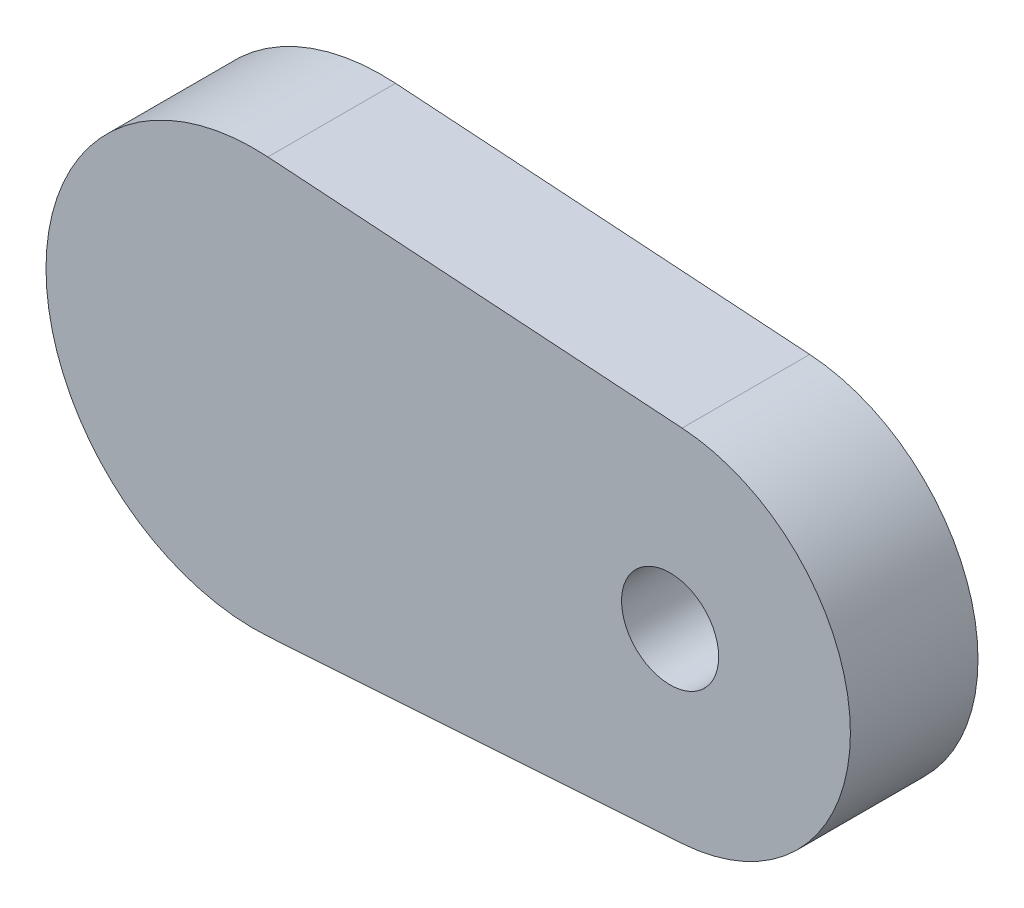
from build123d import *

# Parameters (mm, degrees)
SKETCH1_R      = 1.75
EXTRUDE1_DEPTH = 4.6


with BuildPart() as part:
    # Sketch1 → Extrude1 (new body)
    with BuildSketch(Plane.XY):
        with BuildLine():
            Line((18.056741052, 10.042362485), (32.990074385, 11.040137788))
            ThreePointArc((32.990074385, 11.040137788), (39.056741052, 17.525677258), (32.990074385, 24.011216728))
            Line((32.990074385, 24.011216728), (18.056741052, 25.008992032))
            ThreePointArc((18.056741052, 25.008992032), (10.056741052, 17.525677258), (18.056741052, 10.042362485))
        make_face()
        with Locations((32.556741052, 17.525677258)):
            Circle(SKETCH1_R, mode=Mode.SUBTRACT)
    extrude(amount=EXTRUDE1_DEPTH)


solid = part.part
